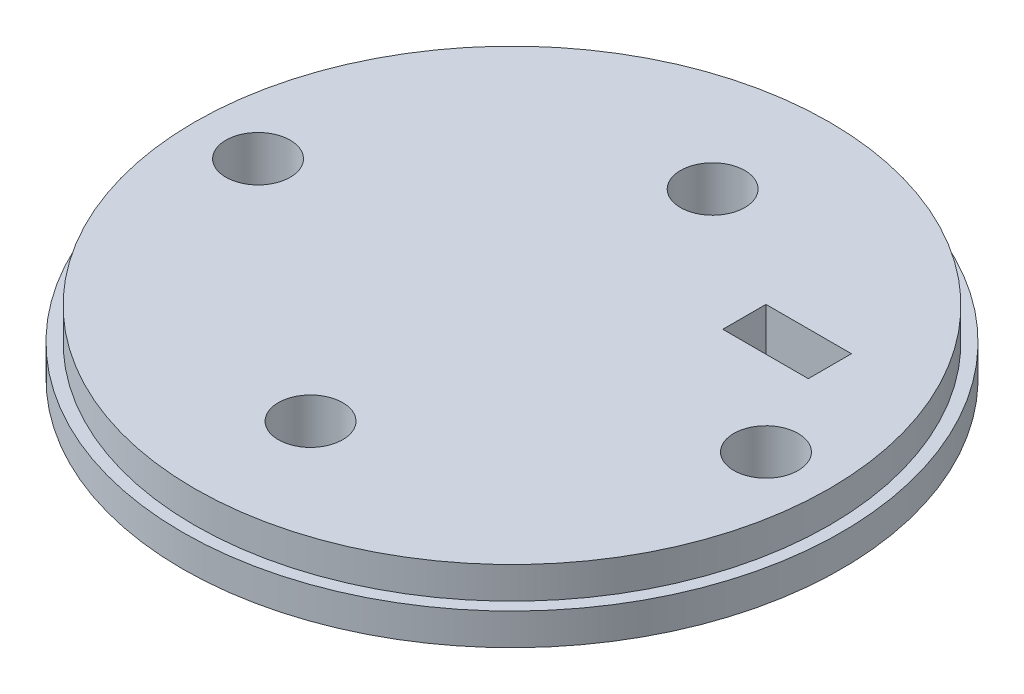
from build123d import *

# Parameters (mm, degrees)
SKETCH1_R               = 49.4411
BOSS_EXTRUDE2_DEPTH     = 9.525
SKETCH4_R               = 50.546
SKETCH4_R_2             = 47.625
CUT_EXTRUDE2_DEPTH      = 4.7625
CUT_EXTRUDE4_DEPTH      = 71.566070908
CUT_EXTRUDE4_DEPTH_BACK = 71.566070908
SKETCH5_R               = 4.826
CUT_EXTRUDE5_DEPTH      = 71.566070908
CUT_EXTRUDE5_DEPTH_BACK = 71.566070908
SKETCH6_W               = 12.827
SKETCH6_H               = 6.477


with BuildPart() as part:
    # Sketch1 → Boss-Extrude2 (new body)
    with BuildSketch(Plane(origin=(0, 0, 0), x_dir=(1, 0, 0), z_dir=(0, 1, 0))):
        with Locations(Location((0, 0, 0), (0, 0, 90))):
            Circle(SKETCH1_R)
    extrude(amount=BOSS_EXTRUDE2_DEPTH)

    # Sketch4 → Cut-Extrude2 (cut)
    with BuildSketch(Plane(origin=(0, 9.525, 0), x_dir=(1, 0, 0), z_dir=(0, 1, 0))):
        Circle(SKETCH4_R)
        with Locations(Location((0, 0, 0), (0, 0, 270))):
            Circle(SKETCH4_R_2, mode=Mode.SUBTRACT)
    extrude(amount=-CUT_EXTRUDE2_DEPTH, mode=Mode.SUBTRACT)

    # Sketch5 → Cut-Extrude4 (cut, two sides: drawn at the far end of the back side and taken through both)
    with BuildSketch(Plane.XZ.offset(-CUT_EXTRUDE4_DEPTH_BACK)):
        with Locations(Location((-0.0635, 30.162076648, 0), (0, 0, 270))):
            Circle(SKETCH5_R)
        with Locations(Location((-0.0635, -30.162076648, 0), (0, 0, 270))):
            Circle(SKETCH5_R)
        with Locations(Location((-38.1, 0, 0), (0, 0, 270))):
            Circle(SKETCH5_R)
        with Locations(Location((38.1, 0, 0), (0, 0, 270))):
            Circle(SKETCH5_R)
    extrude(amount=CUT_EXTRUDE4_DEPTH + CUT_EXTRUDE4_DEPTH_BACK, mode=Mode.SUBTRACT)

    # Sketch6 → Cut-Extrude5 (cut, two sides: drawn at the far end of the back side and taken through both)
    with BuildSketch(Plane(origin=(0, 9.525, 0), x_dir=(1, 0, 0), z_dir=(0, 1, 0)).offset(-CUT_EXTRUDE5_DEPTH_BACK)):
        with Locations((25.3365, 15.9385)):
            Rectangle(SKETCH6_W, SKETCH6_H)
    extrude(amount=CUT_EXTRUDE5_DEPTH + CUT_EXTRUDE5_DEPTH_BACK, mode=Mode.SUBTRACT)


solid = part.part
